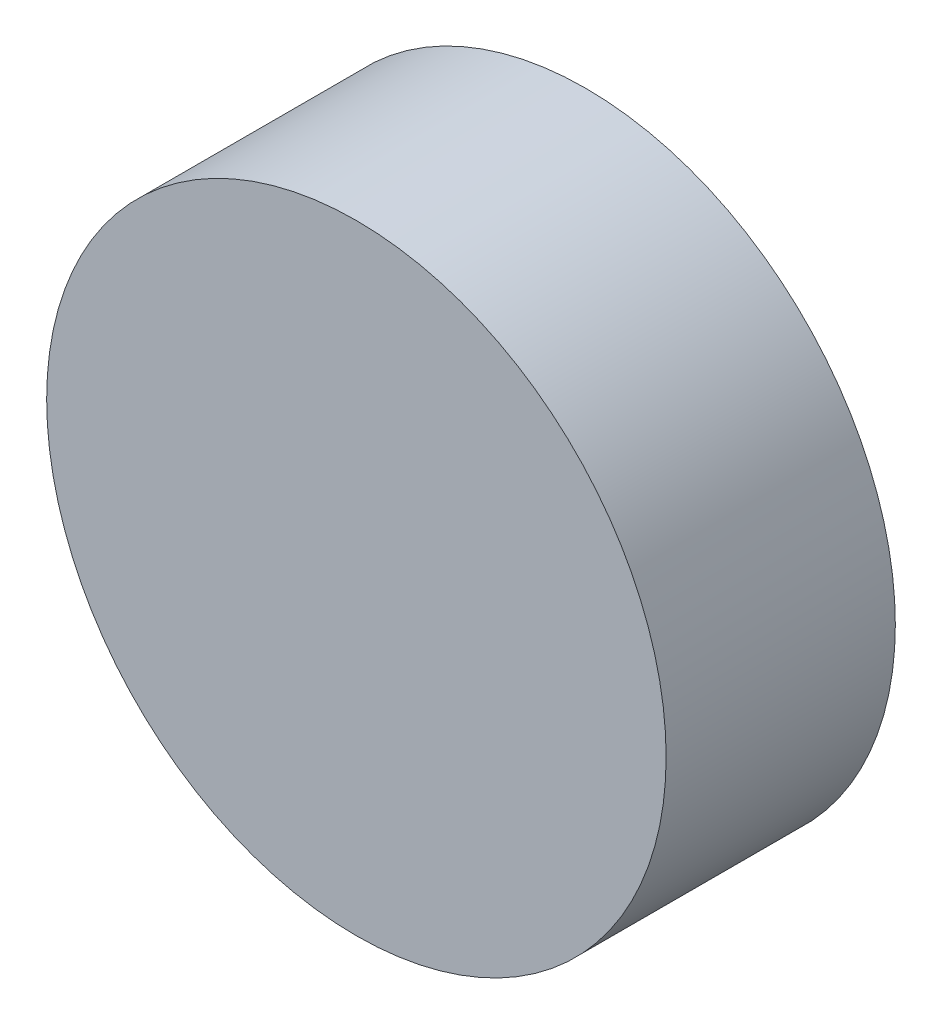
from build123d import *

# Parameters (mm, degrees)
SKETCH1_R           = 1.5
BOSS_EXTRUDE1_DEPTH = 1.11


with BuildPart() as part:
    # Sketch1 → Boss-Extrude1 (new body)
    with BuildSketch(Plane.XY):
        Circle(SKETCH1_R)
    extrude(amount=BOSS_EXTRUDE1_DEPTH)


solid = part.part
